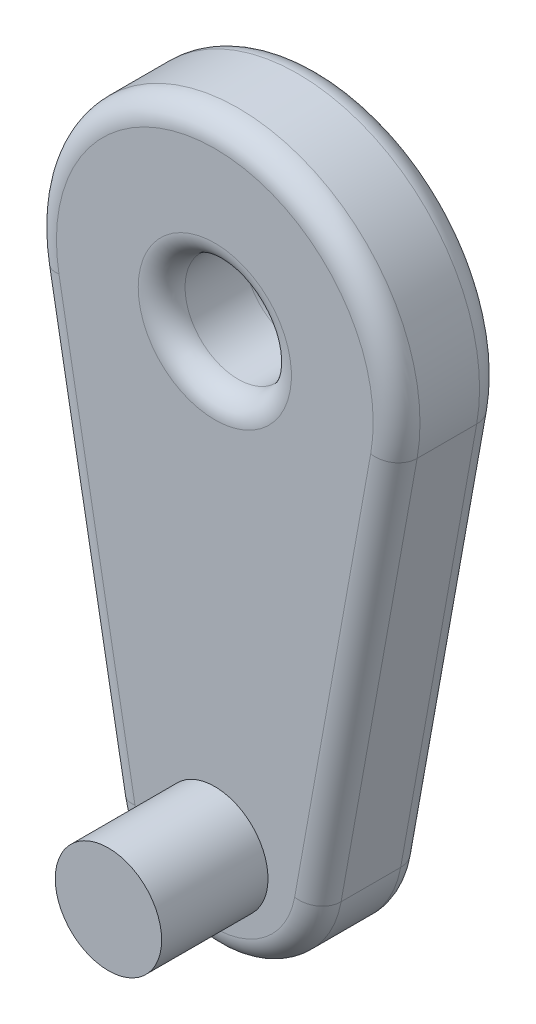
from build123d import *

# Parameters (mm, degrees)
SKETCH2_R           = 2.5
BOSS_EXTRUDE1_DEPTH = 5
FILLET1_R           = 1.1
SKETCH5_R           = 2.5
BOSS_EXTRUDE2_DEPTH = 5


with BuildPart() as part:
    # Sketch2 → Boss-Extrude1 (new body)
    with BuildSketch(Plane.XY):
        with BuildLine():
            Line((-8.409252233, 1.684959921), (-4.836047922, -18.148987446))
            ThreePointArc((-4.836047922, -18.148987446), (0, -22.191645553), (4.836047922, -18.148987446))
            Line((4.836047922, -18.148987446), (8.409252233, 1.684959921))
            ThreePointArc((8.409252233, 1.684959921), (0, 11.744565684), (-8.409252233, 1.684959921))
        make_face()
        with Locations((0, 3.199937034)):
            Circle(SKETCH2_R, mode=Mode.SUBTRACT)
    extrude(amount=BOSS_EXTRUDE1_DEPTH)

    # Fillet1
    fillet1_edges = [part.edges().sort_by_distance(p)[0] for p in [
        (0, -22.191645553, 5),
        (-2.5, 3.199937034, 0),
        (-2.5, 3.199937034, 5),
        (6.622650078, -8.232013763, 5),
        (0, 11.744565684, 5),
        (6.622650078, -8.232013763, 0),
        (0, -22.191645553, 0),
        (-6.622650078, -8.232013763, 0),
        (0, 11.744565684, 0),
        (-6.622650078, -8.232013763, 5),
    ]]
    fillet(fillet1_edges, radius=FILLET1_R)

    # Sketch5 → Boss-Extrude2 (add)
    with BuildSketch(Plane.XY.offset(5)):
        with Locations(Location((0, -17.825950176, 0), (0, 0, 180))):
            Circle(SKETCH5_R)
    extrude(amount=BOSS_EXTRUDE2_DEPTH)


solid = part.part
